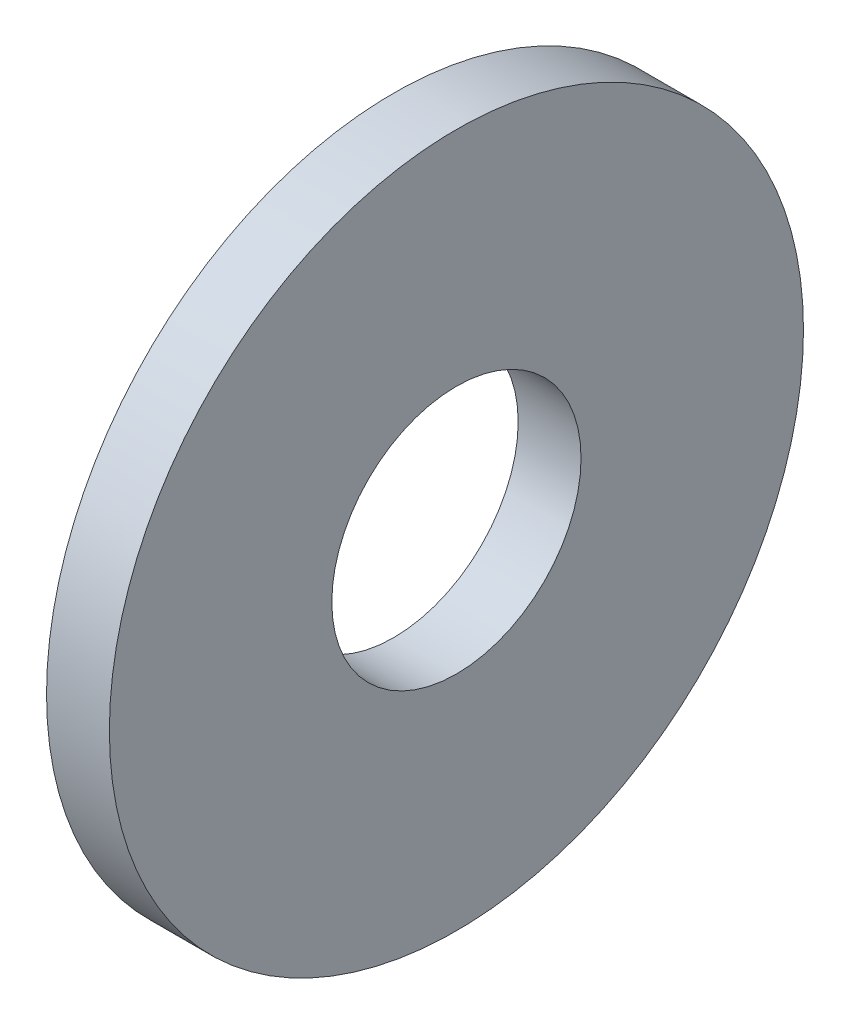
from build123d import *

# Parameters (mm, degrees)
SKETCH1_W = 2.3
SKETCH1_H = 8.14


with BuildPart() as part:
    # Sketch1 → Base-Revolve (revolve)
    with BuildSketch(Plane.XY, mode=Mode.PRIVATE) as base_revolve_sk:
        with Locations((-1.15, 8.63)):
            Rectangle(SKETCH1_W, SKETCH1_H)
    revolve(base_revolve_sk.sketch.rotate(Axis((-34.925, 0, 0), (1, 0, 0)), 90), axis=Axis((-34.925, 0, 0), (1, 0, 0)))


solid = part.part
